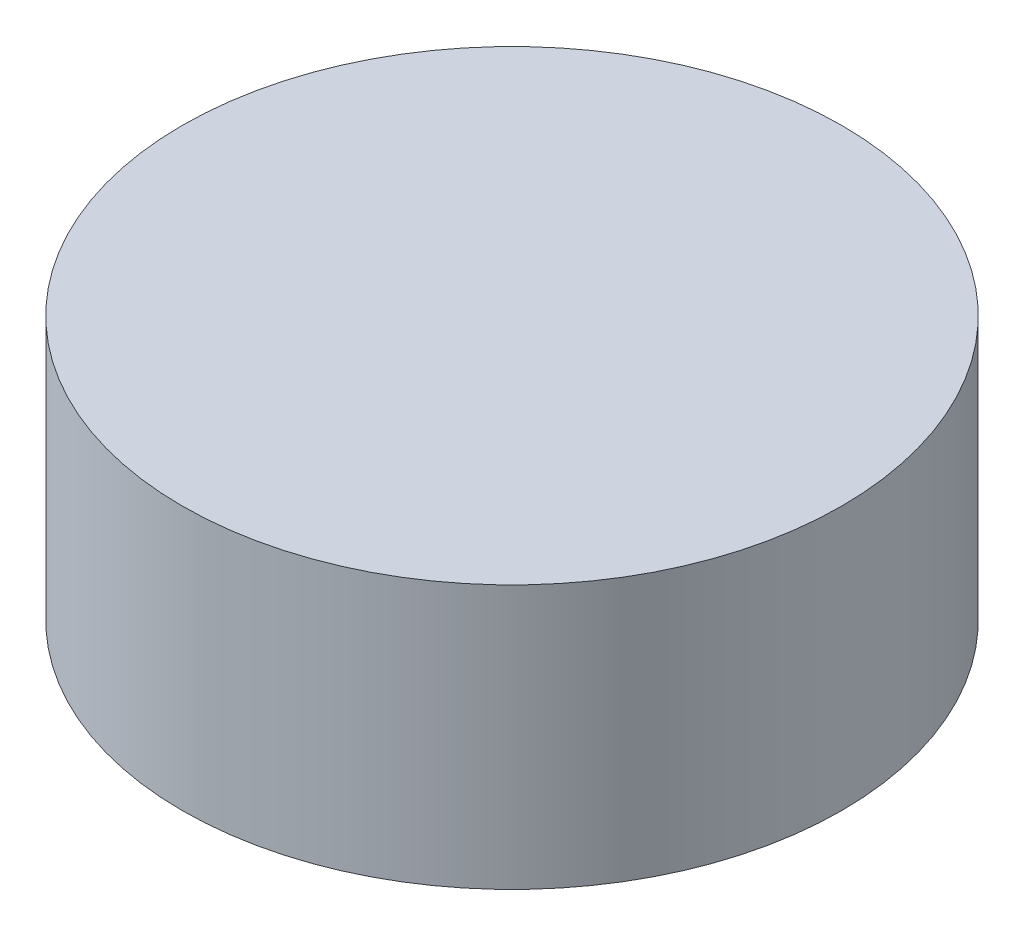
from build123d import *

# Parameters (mm, degrees)
SKETCH1_R           = 3.96875
BOSS_EXTRUDE1_DEPTH = 3.175


with BuildPart() as part:
    # Sketch1 → Boss-Extrude1 (new body)
    with BuildSketch(Plane(origin=(0, 0, 0), x_dir=(1, 0, 0), z_dir=(0, 1, 0))):
        with Locations(Location((0, 0, 0), (0, 0, 270))):
            Circle(SKETCH1_R)
    extrude(amount=BOSS_EXTRUDE1_DEPTH)


solid = part.part
